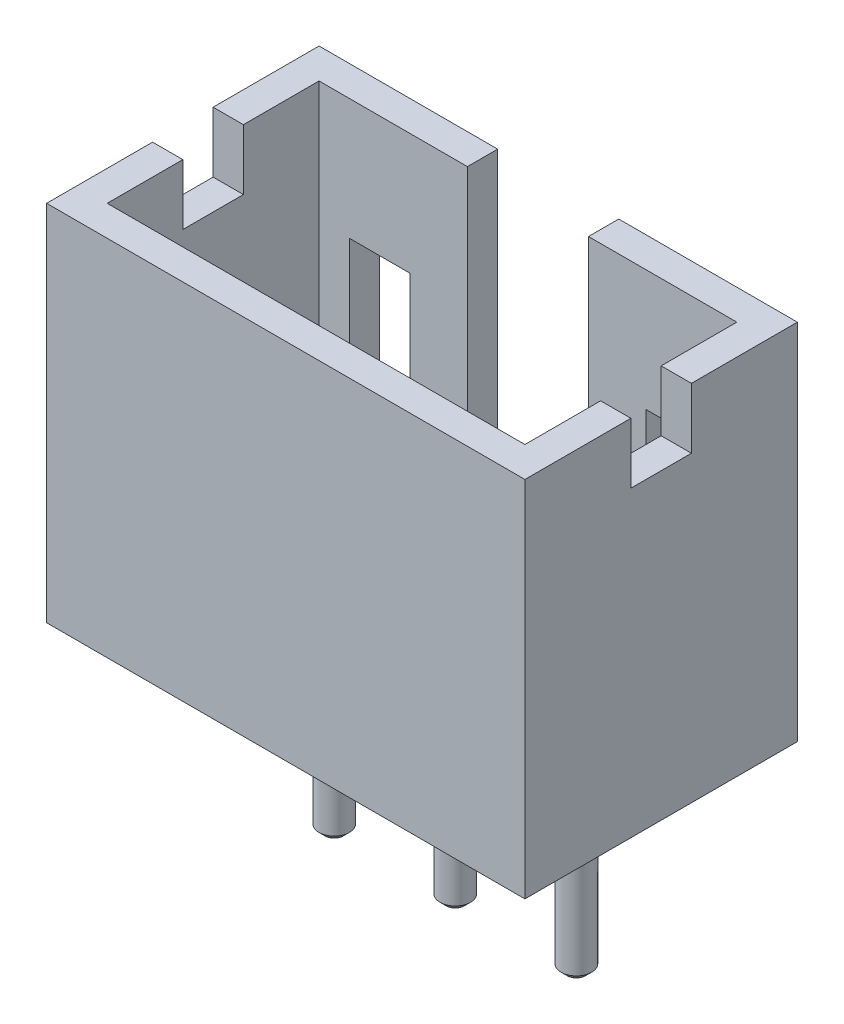
from build123d import *

# Parameters (mm, degrees)
CROQUIS1_W              = 7.9
CROQUIS1_H              = 4.5
SALIENTE_EXTRUIR2_DEPTH = 6
CROQUIS4_W              = 6.9
CROQUIS4_H              = 3.5
CORTAR_EXTRUIR2_DEPTH   = 5
CROQUIS5_R              = 0.25
SALIENTE_EXTRUIR3_DEPTH = 3.4
CROQUIS6_W              = 2
CROQUIS6_H              = 0.5
CORTAR_EXTRUIR3_DEPTH   = 5
CROQUIS7_W              = 1
CROQUIS7_H              = 1
CORTAR_EXTRUIR5_DEPTH   = 8
CROQUIS8_W              = 1
CROQUIS8_H              = 4.000523864
CORTAR_EXTRUIR7_DEPTH   = 0.5
CHAFL_N3_SIZE           = 0.1


with BuildPart() as part:
    # Croquis1 → Saliente-Extruir2 (new body)
    with BuildSketch(Plane(origin=(0, 0, 0), x_dir=(1, 0, 0), z_dir=(0, 1, 0))):
        with Locations((0, -0.55)):
            Rectangle(CROQUIS1_W, CROQUIS1_H)
    extrude(amount=SALIENTE_EXTRUIR2_DEPTH)

    # Croquis4 → Cortar-Extruir2 (cut)
    with BuildSketch(Plane(origin=(0, 6, 0), x_dir=(1, 0, 0), z_dir=(0, 1, 0))):
        with Locations((0, -0.55)):
            Rectangle(CROQUIS4_W, CROQUIS4_H)
    extrude(amount=-CORTAR_EXTRUIR2_DEPTH, mode=Mode.SUBTRACT)

    # Croquis5 → Saliente-Extruir3 (add, symmetric)
    with BuildSketch(Plane(origin=(0, 0, 0), x_dir=(-1, 0, 0), z_dir=(0, -1, 0))):
        with Locations(Location((0, 0, 0), (0, 0, 90))):
            Circle(CROQUIS5_R)
        with Locations(Location((-2, 0, 0), (0, 0, 90))):
            Circle(CROQUIS5_R)
        with Locations(Location((2, 0, 0), (0, 0, 90))):
            Circle(CROQUIS5_R)
    extrude(amount=SALIENTE_EXTRUIR3_DEPTH, both=True)

    # Croquis6 → Cortar-Extruir3 (cut)
    with BuildSketch(Plane(origin=(0, 6, 0), x_dir=(1, 0, 0), z_dir=(0, 1, 0))):
        with Locations((0, 1.45)):
            Rectangle(CROQUIS6_W, CROQUIS6_H)
    extrude(amount=-CORTAR_EXTRUIR3_DEPTH, mode=Mode.SUBTRACT)

    # Croquis7 → Cortar-Extruir5 (cut)
    with BuildSketch(Plane(origin=(3.95, 0, 0), x_dir=(0, 0, -1), z_dir=(1, 0, 0))):
        with Locations((-0.55, 5.5)):
            Rectangle(CROQUIS7_W, CROQUIS7_H)
    extrude(amount=-CORTAR_EXTRUIR5_DEPTH, mode=Mode.SUBTRACT)

    # Croquis8 → Cortar-Extruir7 (cut)
    with BuildSketch(Plane(origin=(0, 0, -1.7), x_dir=(-1, 0, 0), z_dir=(0, 0, -1))):
        with Locations((-2.45, 2.000261932)):
            Rectangle(CROQUIS8_W, CROQUIS8_H)
        with Locations((2.45, 2.000261932)):
            Rectangle(CROQUIS8_W, CROQUIS8_H)
    extrude(amount=-CORTAR_EXTRUIR7_DEPTH, mode=Mode.SUBTRACT)

    # Chaflán3
    chafl_n3_edges = [part.edges().sort_by_distance(p)[0] for p in [
        (0, 3.4, 0.25),
        (0, -3.4, 0.25),
        (2, 3.4, 0.25),
        (2, -3.4, 0.25),
        (-2, 3.4, 0.25),
        (-2, -3.4, 0.25),
    ]]
    chamfer(chafl_n3_edges, length=CHAFL_N3_SIZE)


solid = part.part
